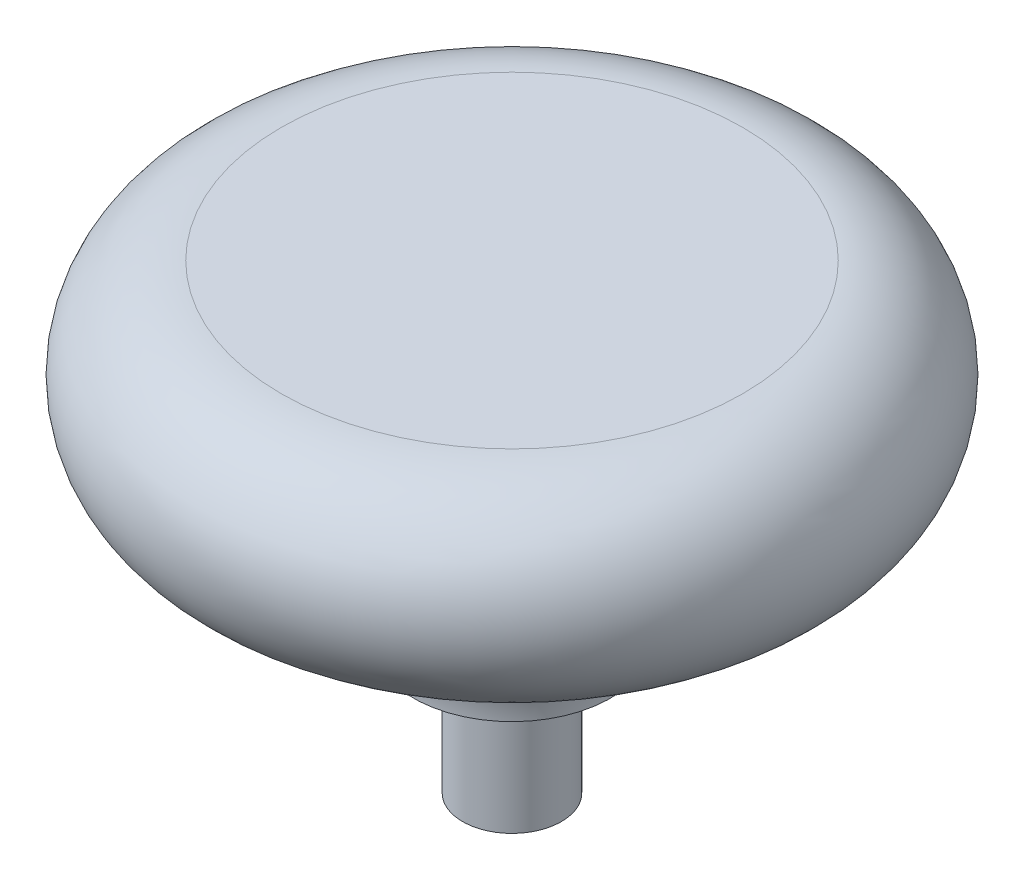
from build123d import *


with BuildPart() as part:
    # Sketch1 → Revolve1 (revolve)
    with BuildSketch(Plane.XY, mode=Mode.PRIVATE) as revolve1_sk:
        with BuildLine():
            Line((0, 0), (2.38, 0))
            Line((2.38, 0), (2.38, 6.35))
            Line((2.38, 6.35), (4.765, 6.35))
            ThreePointArc((4.765, 6.35), (6.624871939, 10.840128061), (11.115, 12.7))
            ThreePointArc((11.115, 12.7), (15.875, 17.46), (11.115, 22.22))
            Line((11.115, 22.22), (0, 22.22))
            Line((0, 22.22), (0, 0))
        make_face()
    revolve(revolve1_sk.sketch.rotate(Axis((0, 0, 0), (0, 1, 0)), 90), axis=Axis((0, 0, 0), (0, 1, 0)))


solid = part.part
